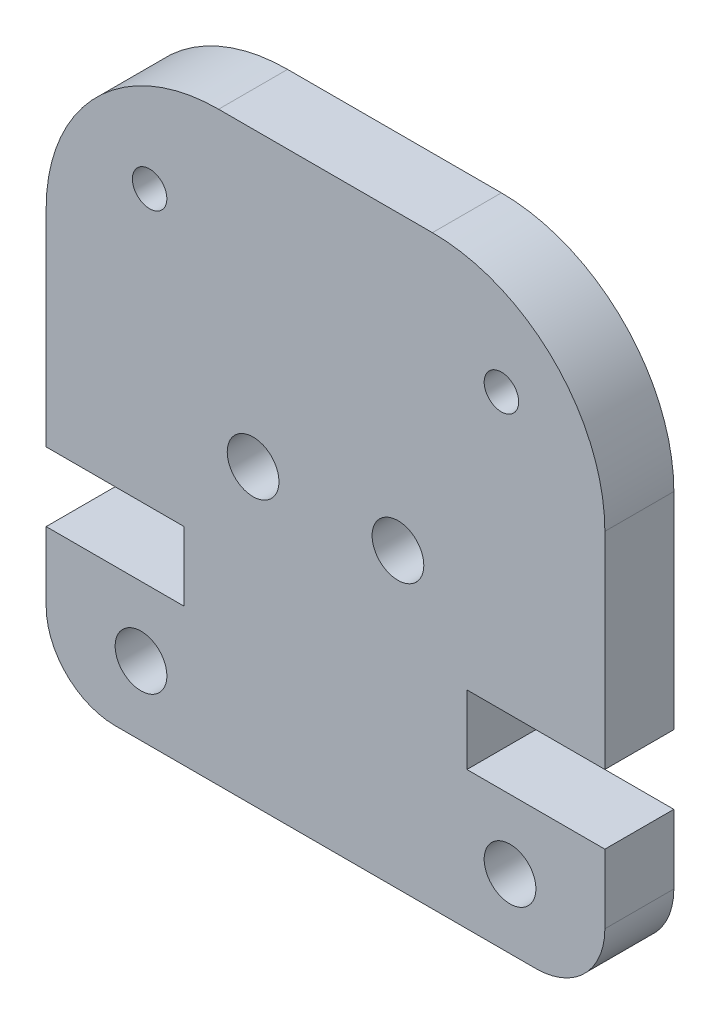
from build123d import *

# Parameters (mm, degrees)
SKETCH1_R           = 0.75
SKETCH1_R_2         = 0.5
BOSS_EXTRUDE1_DEPTH = 2


with BuildPart() as part:
    # Sketch1 → Boss-Extrude1 (new body)
    with BuildSketch(Plane.XY):
        with BuildLine():
            Line((3.1, 16.98), (-3.1, 16.98))
            ThreePointArc((-3.1, 16.98), (-6.635533906, 15.515533906), (-8.1, 11.98))
            Line((-8.1, 11.98), (-8.1, 6))
            Line((-8.1, 6), (-4.1, 6))
            Line((-4.1, 6), (-4.1, 4))
            Line((-4.1, 4), (-8.1, 4))
            Line((-8.1, 4), (-8.1, 2))
            ThreePointArc((-8.1, 2), (-7.514213562, 0.585786438), (-6.1, 0))
            Line((-6.1, 0), (6.1, 0))
            ThreePointArc((6.1, 0), (7.514213562, 0.585786438), (8.1, 2))
            Line((8.1, 2), (8.1, 4))
            Line((8.1, 4), (4.1, 4))
            Line((4.1, 4), (4.1, 6))
            Line((4.1, 6), (8.1, 6))
            Line((8.1, 6), (8.1, 11.98))
            ThreePointArc((8.1, 11.98), (6.635533906, 15.515533906), (3.1, 16.98))
        make_face()
        with Locations(Location((-5.35, 2, 0), (0, 0, 180))):
            Circle(SKETCH1_R, mode=Mode.SUBTRACT)
        with Locations(Location((-5.1, 13.98, 0), (0, 0, 180))):
            Circle(SKETCH1_R_2, mode=Mode.SUBTRACT)
        with Locations(Location((-2.1, 8.5, 0), (0, 0, 180))):
            Circle(SKETCH1_R, mode=Mode.SUBTRACT)
        with Locations((2.1, 8.5)):
            Circle(SKETCH1_R, mode=Mode.SUBTRACT)
        with Locations((5.1, 13.98)):
            Circle(SKETCH1_R_2, mode=Mode.SUBTRACT)
        with Locations((5.35, 2)):
            Circle(SKETCH1_R, mode=Mode.SUBTRACT)
    extrude(amount=BOSS_EXTRUDE1_DEPTH)


solid = part.part
